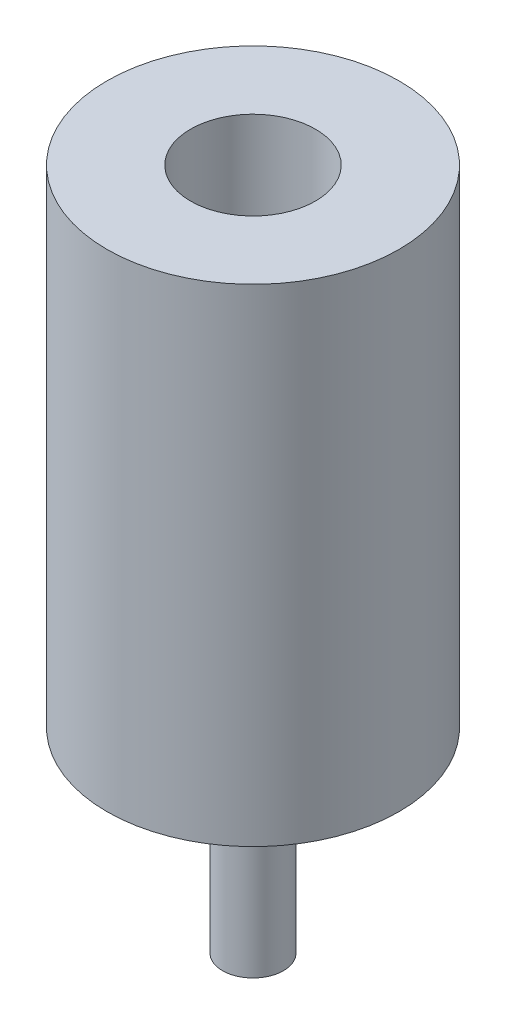
from build123d import *

# Parameters (mm, degrees)
SKETCH1_R           = 2.375
BOSS_EXTRUDE1_DEPTH = 7.92
SKETCH3_R           = 0.495000026
BOSS_EXTRUDE2_DEPTH = 3.18
SKETCH4_R           = 1.015
CUT_EXTRUDE1_DEPTH  = 6.35


with BuildPart() as part:
    # Sketch1 → Boss-Extrude1 (new body)
    with BuildSketch(Plane(origin=(0, 0, 0), x_dir=(1, 0, 0), z_dir=(0, 1, 0))):
        with Locations(Location((0, 0, 0), (0, 0, 270))):
            Circle(SKETCH1_R)
    extrude(amount=BOSS_EXTRUDE1_DEPTH)

    # Sketch3 → Boss-Extrude2 (add)
    with BuildSketch(Plane(origin=(0, 0, 0), x_dir=(-1, 0, 0), z_dir=(0, -1, 0))):
        with Locations(Location((0, 0, 0), (0, 0, 270))):
            Circle(SKETCH3_R)
    extrude(amount=BOSS_EXTRUDE2_DEPTH)

    # Sketch4 → Cut-Extrude1 (cut)
    with BuildSketch(Plane(origin=(0, 7.92, 0), x_dir=(1, 0, 0), z_dir=(0, 1, 0))):
        with Locations(Location((0, 0, 0), (0, 0, 270))):
            Circle(SKETCH4_R)
    extrude(amount=-CUT_EXTRUDE1_DEPTH, mode=Mode.SUBTRACT)


solid = part.part
